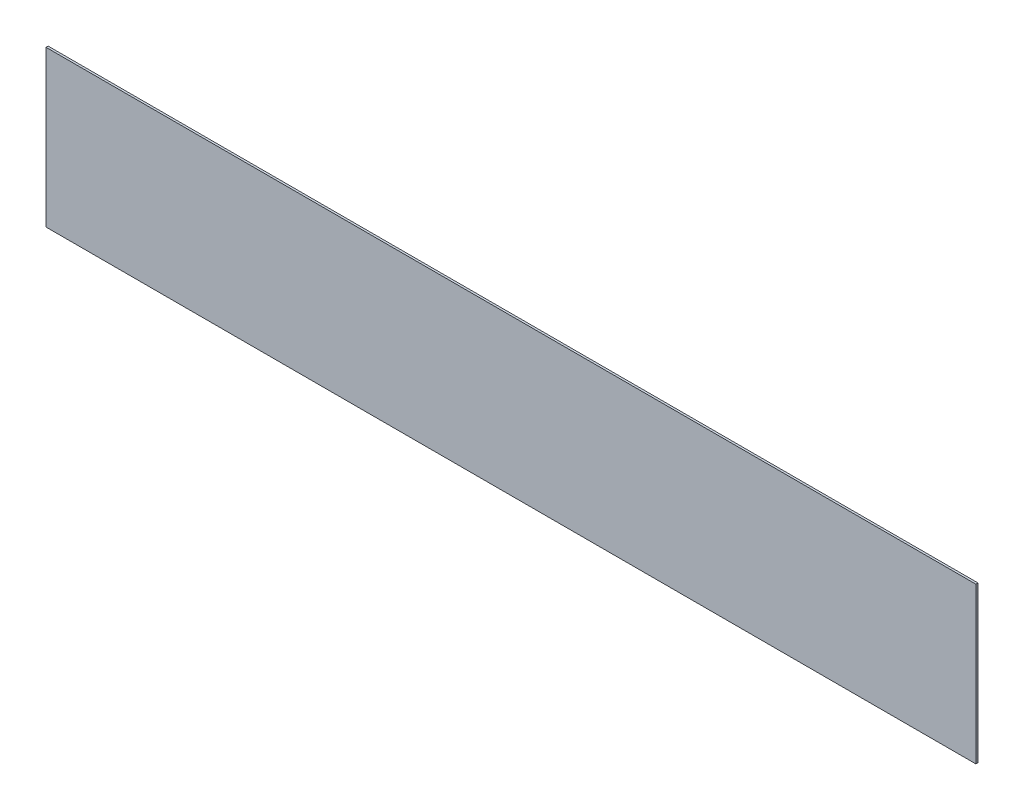
from build123d import *

# Parameters (mm, degrees)
OVEN_PLINT_ARKA_1_START = -798.5
SKETCH1_W               = 657
SKETCH1_H               = 110
OVEN_PLINT_ARKA_1_DEPTH = 1.5


with BuildPart() as part:
    # Sketch1 → OVEN_plint_arka_1 (new body)
    with BuildSketch(Plane.XY.offset(OVEN_PLINT_ARKA_1_START)):
        with Locations((350, 65)):
            Rectangle(SKETCH1_W, SKETCH1_H)
    extrude(amount=-OVEN_PLINT_ARKA_1_DEPTH)


solid = part.part
